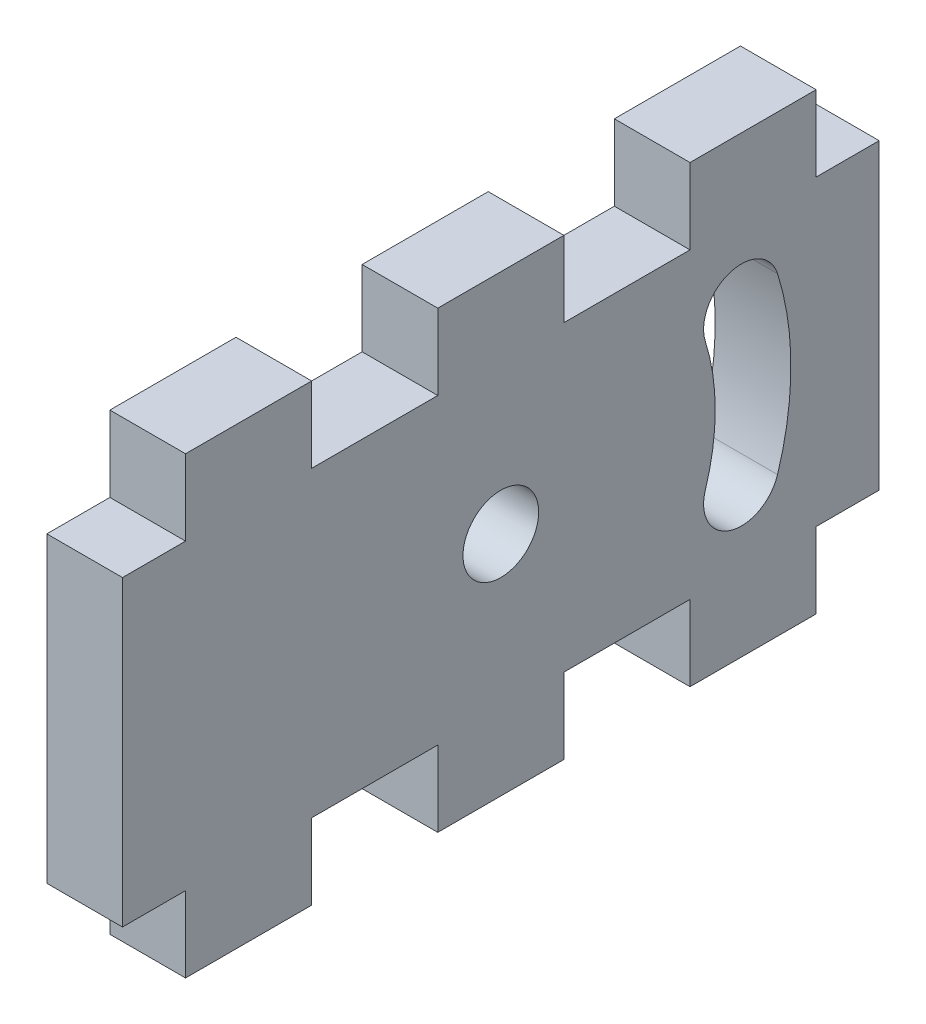
from build123d import *

# Parameters (mm, degrees)
SKETCH1_W           = 30
SKETCH1_H           = 12
BOSS_EXTRUDE1_DEPTH = 3
SKETCH3_W           = 5
SKETCH3_H           = 3
BOSS_EXTRUDE2_DEPTH = 3
SKETCH4_R           = 1.5
CUT_EXTRUDE1_DEPTH  = 10


with BuildPart() as part:
    # Sketch1 → Boss-Extrude1 (new body)
    with BuildSketch(Plane(origin=(0, 0, 0), x_dir=(0, 0, -1), z_dir=(1, 0, 0))):
        Rectangle(SKETCH1_W, SKETCH1_H)
    extrude(amount=BOSS_EXTRUDE1_DEPTH)

    # Sketch3 → Boss-Extrude2 (add)
    with BuildSketch(Plane(origin=(3, 0, 0), x_dir=(0, 0, -1), z_dir=(1, 0, 0))):
        with Locations((-10, 7.5)):
            Rectangle(SKETCH3_W, SKETCH3_H)
        with Locations((0, 7.5)):
            Rectangle(SKETCH3_W, SKETCH3_H)
        with Locations((10, 7.5)):
            Rectangle(SKETCH3_W, SKETCH3_H)
        with Locations((10, -7.5)):
            Rectangle(SKETCH3_W, SKETCH3_H)
        with Locations((0, -7.5)):
            Rectangle(SKETCH3_W, SKETCH3_H)
        with Locations((-10, -7.5)):
            Rectangle(SKETCH3_W, SKETCH3_H)
    extrude(amount=-BOSS_EXTRUDE2_DEPTH)

    # Sketch4 → Cut-Extrude1 (cut)
    with BuildSketch(Plane(origin=(3, 0, 0), x_dir=(0, 0, -1), z_dir=(1, 0, 0))):
        Circle(SKETCH4_R)
        with BuildLine():
            ThreePointArc((10.970300816, -3.45), (11.5, 0), (10.970300816, 3.45))
            ThreePointArc((10.970300816, 3.45), (9.089392014, 4.430908802), (8.108483212, 2.55))
            ThreePointArc((8.108483212, 2.55), (8.5, 0), (8.108483212, -2.55))
            ThreePointArc((8.108483212, -2.55), (9.089392014, -4.430908802), (10.970300816, -3.45))
        make_face()
    extrude(amount=-CUT_EXTRUDE1_DEPTH, mode=Mode.SUBTRACT)


solid = part.part
